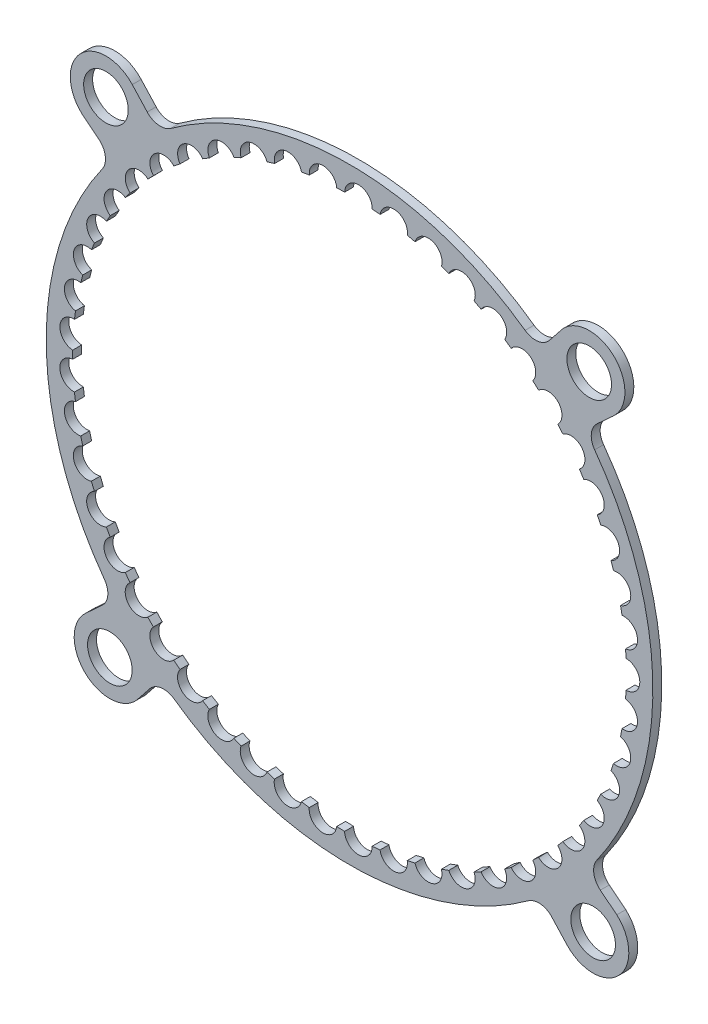
from build123d import *

# Parameters (mm, degrees)
SKETCH_1_R      = 2.5
EXTRUDE_1_DEPTH = 1


with BuildPart() as part:
    # 草图1 → 凸台-拉伸1 (new body)
    with BuildSketch(Plane.XY):
        with BuildLine():
            Line((24.353070518, -29.56688995), (22.681496979, -27.740758728))
            ThreePointArc((22.681496979, -27.740758728), (21.405560026, -27.101120587), (20.028107344, -27.474987101))
            ThreePointArc((20.028107344, -27.474987101), (0.214755371, -33.99932176), (-19.679433767, -27.725798214))
            ThreePointArc((-19.679433767, -27.725798214), (-21.116809592, -27.376390887), (-22.401146138, -28.110294408))
            Line((-22.401146138, -28.110294408), (-23.8723102, -29.956398828))
            ThreePointArc((-23.8723102, -29.956398828), (-29.671572633, -30.154780757), (-29.56688995, -24.353070518))
            Line((-29.56688995, -24.353070518), (-27.740758728, -22.681496979))
            ThreePointArc((-27.740758728, -22.681496979), (-27.101120587, -21.405560026), (-27.474987101, -20.028107344))
            ThreePointArc((-27.474987101, -20.028107344), (-33.99932176, -0.214755371), (-27.725798214, 19.679433767))
            ThreePointArc((-27.725798214, 19.679433767), (-27.376390887, 21.116809592), (-28.110294408, 22.401146138))
            Line((-28.110294408, 22.401146138), (-29.956398828, 23.8723102))
            ThreePointArc((-29.956398828, 23.8723102), (-30.154780757, 29.671572633), (-24.353070518, 29.56688995))
            Line((-24.353070518, 29.56688995), (-22.681496979, 27.740758728))
            ThreePointArc((-22.681496979, 27.740758728), (-21.405560026, 27.101120587), (-20.028107344, 27.474987101))
            ThreePointArc((-20.028107344, 27.474987101), (-0.214755371, 33.99932176), (19.679433767, 27.725798214))
            ThreePointArc((19.679433767, 27.725798214), (21.116809592, 27.376390887), (22.401146138, 28.110294408))
            Line((22.401146138, 28.110294408), (23.8723102, 29.956398828))
            ThreePointArc((23.8723102, 29.956398828), (29.671572633, 30.154780757), (29.56688995, 24.353070518))
            Line((29.56688995, 24.353070518), (27.740758728, 22.681496979))
            ThreePointArc((27.740758728, 22.681496979), (27.101120587, 21.405560026), (27.474987101, 20.028107344))
            ThreePointArc((27.474987101, 20.028107344), (33.99932176, 0.214755371), (27.725798214, -19.679433767))
            ThreePointArc((27.725798214, -19.679433767), (27.376390887, -21.116809592), (28.110294408, -22.401146138))
            Line((28.110294408, -22.401146138), (29.956398828, -23.8723102))
            ThreePointArc((29.956398828, -23.8723102), (30.154780757, -29.671572633), (24.353070518, -29.56688995))
        make_face()
        with Locations((27.303601865, -26.86608178)):
            Circle(SKETCH_1_R, mode=Mode.SUBTRACT)
        with Locations((-26.86608178, -27.303601865)):
            Circle(SKETCH_1_R, mode=Mode.SUBTRACT)
        with Locations((-27.303601865, 26.86608178)):
            Circle(SKETCH_1_R, mode=Mode.SUBTRACT)
        with Locations((26.86608178, 27.303601865)):
            Circle(SKETCH_1_R, mode=Mode.SUBTRACT)
        with BuildLine():
            Line((30.967380809, -1.988171813), (30.995571706, -1.54907584))
            ThreePointArc((30.995571706, -1.54907584), (32.086109964, -1.093363959), (32.535, 0))
            ThreePointArc((32.535, 0), (32.082923383, 1.086913605), (30.996191231, 1.539426235))
            Line((30.996191231, 1.539426235), (30.967380809, 1.988171813))
            Line((30.967380809, 1.988171813), (30.939189912, 2.427267786))
            ThreePointArc((30.939189912, 2.427267786), (31.962499724, 3.018693216), (32.2678881, 4.160483455))
            ThreePointArc((32.2678881, 4.160483455), (31.680531599, 5.18066324), (30.544855472, 5.490492524))
            Line((30.544855472, 5.490492524), (30.458897272, 5.931869712))
            Line((30.458897272, 5.931869712), (30.374787475, 6.363755741))
            ThreePointArc((30.374787475, 6.363755741), (31.314066123, 7.081183531), (31.470938369, 8.252651887))
            ThreePointArc((31.470938369, 8.252651887), (30.757946362, 9.189346528), (29.59197403, 9.351405078))
            Line((29.59197403, 9.351405078), (29.450279484, 9.778166475))
            Line((29.450279484, 9.778166475), (29.311631868, 10.195751004))
            ThreePointArc((29.311631868, 10.195751004), (30.151456422, 11.027401009), (30.1572367, 12.209312004))
            ThreePointArc((30.1572367, 12.209312004), (29.330316496, 13.047141), (28.153193193, 13.05876782))
            Line((28.153193193, 13.05876782), (27.958088921, 13.463906015))
            Line((27.958088921, 13.463906015), (27.767180076, 13.860332317))
            ThreePointArc((27.767180076, 13.860332317), (28.493760639, 14.792548867), (28.348354039, 15.965495554))
            ThreePointArc((28.348354039, 15.965495554), (27.421083643, 16.690701777), (26.252137703, 16.551705954))
            Line((26.252137703, 16.551705954), (26.006827311, 16.92856859))
            Line((26.006827311, 16.92856859), (25.766791955, 17.297327356))
            ThreePointArc((25.766791955, 17.297327356), (26.368198095, 18.314803482), (26.073992187, 19.45952611))
            ThreePointArc((26.073992187, 19.45952611), (25.061597356, 20.060201693), (23.920022836, 19.772865535))
            Line((23.920022836, 19.772865535), (23.628534316, 20.115264537))
            Line((23.628534316, 20.115264537), (23.343313822, 20.450300759))
            ThreePointArc((23.343313822, 20.450300759), (23.809670467, 21.536329529), (23.371496105, 22.634031784))
            ThreePointArc((23.371496105, 22.634031784), (22.290600333, 23.100313652), (21.195141857, 22.66935521))
            Line((21.195141857, 22.66935521), (20.86226144, 22.971668396))
            Line((20.86226144, 22.971668396), (20.536539122, 23.267480788))
            ThreePointArc((20.536539122, 23.267480788), (20.860188709, 24.404229642), (20.285240703, 25.436887282))
            ThreePointArc((20.285240703, 25.436887282), (19.153592268, 25.761119099), (18.122237234, 25.193614699))
            Line((18.122237234, 25.193614699), (17.753430809, 25.450878096))
            Line((17.753430809, 25.450878096), (17.392555017, 25.702609426))
            ThreePointArc((17.392555017, 25.702609426), (17.568183228, 26.871412978), (16.86590221, 27.822069794))
            ThreePointArc((16.86590221, 27.822069794), (15.702082748, 27.998927682), (14.751765976, 27.304195731))
            Line((14.751765976, 27.304195731), (14.353089334, 27.51218508))
            Line((14.353089334, 27.51218508), (13.962985639, 27.715701928))
            ThreePointArc((13.962985639, 27.715701928), (13.987708665, 28.897368456), (13.169626068, 29.75041469))
            ThreePointArc((13.169626068, 29.75041469), (11.992745464, 29.776994647), (11.139071129, 28.966442625))
            Line((11.139071129, 28.966442625), (10.717070529, 29.121742746))
            Line((10.717070529, 29.121742746), (10.304144423, 29.27370337))
            ThreePointArc((10.304144423, 29.27370337), (10.177556312, 30.448829943), (9.257105031, 31.190258599))
            ThreePointArc((9.257105031, 31.190258599), (8.08648763, 31.066124184), (7.343473042, 30.153061331))
            Line((7.343473042, 30.153061331), (6.905077723, 30.253122202))
            Line((6.905077723, 30.253122202), (6.476109441, 30.351031413))
            ThreePointArc((6.476109441, 30.351031413), (6.200288765, 31.500322484), (5.192582585, 32.117959323))
            ThreePointArc((5.192582585, 32.117959323), (4.047449894, 31.84514882), (3.427295331, 30.844567604))
            Line((3.427295331, 30.844567604), (2.979703731, 30.887746227))
            Line((2.979703731, 30.887746227), (2.541736921, 30.929996359))
            ThreePointArc((2.541736921, 30.929996359), (2.121212649, 32.034580601), (1.042798076, 32.518284044))
            ThreePointArc((1.042798076, 32.518284044), (-0.058046858, 32.101276993), (-0.545158475, 31.029606929))
            Line((-0.545158475, 31.029606929), (-0.994596914, 31.015194313))
            Line((-0.994596914, 31.015194313), (-1.434370849, 31.001091619))
            ThreePointArc((-1.434370849, 31.001091619), (-1.992693721, 32.04283179), (-3.124109148, 32.38465944))
            ThreePointArc((-3.124109148, 32.38465944), (-4.162590483, 31.830303085), (-4.508660794, 30.705140967))
            Line((-4.508660794, 30.705140967), (-4.952566305, 30.633373766))
            Line((-4.952566305, 30.633373766), (-5.38692629, 30.563149813))
            ThreePointArc((-5.38692629, 30.563149813), (-6.073880114, 31.524940566), (-7.239718586, 31.719279623))
            ThreePointArc((-7.239718586, 31.719279623), (-8.198784487, 31.03667648), (-8.398131027, 29.876497439))
            Line((-8.398131027, 29.876497439), (-8.829214694, 29.748554069))
            Line((-8.829214694, 29.748554069), (-9.25102855, 29.623361931))
            ThreePointArc((-9.25102855, 29.623361931), (-10.055333565, 30.489410691), (-11.236452046, 30.533070111))
            ThreePointArc((-11.236452046, 30.533070111), (-12.100354676, 29.733428506), (-12.149704181, 28.557282649))
            Line((-12.149704181, 28.557282649), (-12.560887622, 28.375263936))
            Line((-12.560887622, 28.375263936), (-12.963229176, 28.197159265))
            ThreePointArc((-12.963229176, 28.197159265), (-13.871678716, 28.953245534), (-15.048683273, 28.845508433))
            ThreePointArc((-15.048683273, 28.845508433), (-15.803237376, 27.941958458), (-15.701779528, 26.769158067))
            Line((-15.701779528, 26.769158067), (-16.086311123, 26.536052754))
            Line((-16.086311123, 26.536052754), (-16.462573939, 26.307960024))
            ThreePointArc((-16.462573939, 26.307960024), (-17.460251286, 26.941668887), (-18.613815537, 26.684304303))
            ThreePointArc((-18.613815537, 26.684304303), (-19.246631355, 25.691682224), (-18.996032089, 24.54148465))
            Line((-18.996032089, 24.54148465), (-19.347597839, 24.26112032))
            Line((-19.347597839, 24.26112032), (-19.691603692, 23.986784807))
            ThreePointArc((-19.691603692, 23.986784807), (-20.762127012, 24.487710781), (-21.873309465, 24.084944635))
            ThreePointArc((-21.873309465, 24.084944635), (-22.373996179, 23.019549278), (-21.978370329, 21.910840733))
            Line((-21.978370329, 21.910840733), (-22.291197534, 21.58782096))
            Line((-22.291197534, 21.58782096), (-22.597297857, 21.271747246))
            ThreePointArc((-22.597297857, 21.271747246), (-23.723089187, 21.631665141), (-24.773644256, 21.090110841))
            ThreePointArc((-24.773644256, 21.090110841), (-25.133980605, 19.96943597), (-24.599824335, 18.920421417))
            Line((-24.599824335, 18.920421417), (-24.868776382, 18.560050177))
            Line((-24.868776382, 18.560050177), (-25.131945015, 18.207428184))
            ThreePointArc((-25.131945015, 18.207428184), (-26.294518894, 18.420428158), (-27.267196493, 17.748978011))
            ThreePointArc((-27.267196493, 17.748978011), (-27.481265764, 16.591425075), (-26.817349906, 15.619329305))
            Line((-26.817349906, 15.619329305), (-27.038010609, 15.227523883))
            Line((-27.038010609, 15.227523883), (-27.253926332, 14.844143654))
            ThreePointArc((-27.253926332, 14.844143654), (-28.434193327, 14.906728253), (-29.313022117, 14.116407452))
            ThreePointArc((-29.313022117, 14.116407452), (-29.377309298, 12.940983439), (-28.594535333, 12.061768238))
            Line((-28.594535333, 12.061768238), (-28.763281449, 11.644962069))
            Line((-28.763281449, 11.644962069), (-28.928398932, 11.237118695))
            ThreePointArc((-28.928398932, 11.237118695), (-30.106979092, 11.148260283), (-30.877528729, 10.252045873))
            ThreePointArc((-30.877528729, 10.252045873), (-30.790978227, 9.078051213), (-29.902199281, 8.306153269))
            Line((-29.902199281, 8.306153269), (-30.016260004, 7.871190298))
            Line((-30.016260004, 7.871190298), (-30.127868021, 7.445580559))
            ThreePointArc((-30.127868021, 7.445580559), (-31.285409092, 7.206738187), (-31.935027173, 6.219345985))
            ThreePointArc((-31.935027173, 6.219345985), (-31.699060144, 5.066057637), (-30.718869943, 4.414151493))
            Line((-30.718869943, 4.414151493), (-30.776372398, 3.968173801))
            Line((-30.776372398, 3.968173801), (-30.832638349, 3.531786195))
            ThreePointArc((-30.832638349, 3.531786195), (-31.95013354, 3.146881649), (-32.468153353, 2.084524607))
            ThreePointArc((-32.468153353, 2.084524607), (-32.08664437, 0.970879535), (-31.031137609, 0.449669472))
            Line((-31.031137609, 0.449669472), (-31.031137609, 0))
            Line((-31.031137609, 0), (-31.031137609, -0.44))
            ThreePointArc((-31.031137609, -0.44), (-32.090237679, -0.964646598), (-32.468153353, -2.084524607))
            ThreePointArc((-32.468153353, -2.084524607), (-31.947366782, -3.140240383), (-30.833874854, -3.522196109))
            Line((-30.833874854, -3.522196109), (-30.776372398, -3.968173801))
            Line((-30.776372398, -3.968173801), (-30.720106447, -4.404561407))
            ThreePointArc((-30.720106447, -4.404561407), (-31.703421002, -5.060335375), (-31.935027173, -6.219345985))
            ThreePointArc((-31.935027173, -6.219345985), (-31.283514316, -7.19979764), (-30.130320726, -7.436227328))
            Line((-30.130320726, -7.436227328), (-30.016260004, -7.871190298))
            Line((-30.016260004, -7.871190298), (-29.904651987, -8.296800038))
            ThreePointArc((-29.904651987, -8.296800038), (-30.796035029, -9.072933585), (-30.877528729, -10.252045873))
            ThreePointArc((-30.877528729, -10.252045873), (-30.105987409, -11.141134419), (-28.932027565, -11.2281559))
            Line((-28.932027565, -11.2281559), (-28.763281449, -11.644962069))
            Line((-28.763281449, -11.644962069), (-28.598163967, -12.052805442))
            ThreePointArc((-28.598163967, -12.052805442), (-29.382979012, -12.936554477), (-29.313022117, -14.116407452))
            ThreePointArc((-29.313022117, -14.116407452), (-28.434121021, -14.899534079), (-27.258671312, -14.835718462))
            Line((-27.258671312, -14.835718462), (-27.038010609, -15.227523883))
            Line((-27.038010609, -15.227523883), (-26.822094886, -15.610904113))
            ThreePointArc((-26.822094886, -15.610904113), (-27.487455292, -16.587757501), (-27.267196493, -17.748978011))
            ThreePointArc((-27.267196493, -17.748978011), (-26.295367152, -18.413283801), (-25.137728429, -18.199678937))
            Line((-25.137728429, -18.199678937), (-24.868776382, -18.560050177))
            Line((-24.868776382, -18.560050177), (-24.605607749, -18.912672171))
            ThreePointArc((-24.605607749, -18.912672171), (-25.140588316, -19.966590006), (-24.773644256, -21.090110841))
            ThreePointArc((-24.773644256, -21.090110841), (-23.724844081, -21.624687913), (-22.60402474, -21.264801187))
            Line((-22.60402474, -21.264801187), (-22.291197534, -21.58782096))
            Line((-22.291197534, -21.58782096), (-21.985097212, -21.903894674))
            ThreePointArc((-21.985097212, -21.903894674), (-22.380913575, -23.017571655), (-21.873309465, -24.084944635))
            ThreePointArc((-21.873309465, -24.084944635), (-20.764759726, -24.481015246), (-19.699163589, -23.98075599))
            Line((-19.699163589, -23.98075599), (-19.347597839, -24.26112032))
            Line((-19.347597839, -24.26112032), (-19.003591987, -24.535455832))
            ThreePointArc((-19.003591987, -24.535455832), (-19.253744852, -25.690605414), (-18.613815537, -26.684304303))
            ThreePointArc((-18.613815537, -26.684304303), (-17.463718591, -26.935364987), (-16.470842718, -26.302947442))
            Line((-16.470842718, -26.302947442), (-16.086311123, -26.536052754))
            Line((-16.086311123, -26.536052754), (-15.710048307, -26.764145484))
            ThreePointArc((-15.710048307, -26.764145484), (-15.810430171, -27.941800142), (-15.048683273, -28.845508433))
            ThreePointArc((-15.048683273, -28.845508433), (-13.87592368, -28.947436778), (-12.972071064, -28.193245224))
            Line((-12.972071064, -28.193245224), (-12.560887622, -28.375263936))
            Line((-12.560887622, -28.375263936), (-12.158546068, -28.553368607))
            ThreePointArc((-12.158546068, -28.553368607), (-12.107508663, -29.734191284), (-11.236452046, -30.533070111))
            ThreePointArc((-11.236452046, -30.533070111), (-10.060286485, -30.484192458), (-9.260298362, -29.620610699))
            Line((-9.260298362, -29.620610699), (-8.829214694, -29.748554069))
            Line((-8.829214694, -29.748554069), (-8.407400839, -29.873746207))
            ThreePointArc((-8.407400839, -29.873746207), (-8.205782198, -31.038347828), (-7.239718586, -31.719279623))
            ThreePointArc((-7.239718586, -31.719279623), (-6.079459664, -31.520398541), (-5.396471817, -30.561606566))
            Line((-5.396471817, -30.561606566), (-4.952566305, -30.633373766))
            Line((-4.952566305, -30.633373766), (-4.51820632, -30.70359772))
            ThreePointArc((-4.51820632, -30.70359772), (-4.169317016, -31.832855558), (-3.124109148, -32.38465944))
            ThreePointArc((-3.124109148, -32.38465944), (-1.998808284, -32.039040551), (-1.444035353, -31.000781697))
            Line((-1.444035353, -31.000781697), (-0.994596914, -31.015194313))
            Line((-0.994596914, -31.015194313), (-0.554822979, -31.029297008))
            ThreePointArc((-0.554822979, -31.029297008), (-0.064391764, -32.10466868), (1.042798076, -32.518284044))
            ThreePointArc((1.042798076, -32.518284044), (2.114663474, -32.031602401), (2.53211213, -30.930924851))
            Line((2.53211213, -30.930924851), (2.979703731, -30.887746227))
            Line((2.979703731, -30.887746227), (3.41767054, -30.845496096))
            ThreePointArc((3.41767054, -30.845496096), (4.041590799, -31.84932403), (5.192582585, -32.117959323))
            ThreePointArc((5.192582585, -32.117959323), (6.193412515, -31.498206225), (6.466682403, -30.353183073))
            Line((6.466682403, -30.353183073), (6.905077723, -30.253122202))
            Line((6.905077723, -30.253122202), (7.334046004, -30.155212991))
            ThreePointArc((7.334046004, -30.155212991), (8.081210553, -31.07101436), (9.257105031, -31.190258599))
            ThreePointArc((9.257105031, -31.190258599), (10.170465894, -30.447610374), (10.295069929, -29.277042868))
            Line((10.295069929, -29.277042868), (10.717070529, -29.121742746))
            Line((10.717070529, -29.121742746), (11.129996635, -28.969782123))
            ThreePointArc((11.129996635, -28.969782123), (11.988137053, -29.782519493), (13.169626068, -29.75041469))
            ThreePointArc((13.169626068, -29.75041469), (13.980520504, -28.897065602), (13.954412692, -27.720174429))
            Line((13.954412692, -27.720174429), (14.353089334, -27.51218508))
            Line((14.353089334, -27.51218508), (14.743193029, -27.308668233))
            ThreePointArc((14.743193029, -27.308668233), (15.698218674, -28.004996479), (16.86590221, -27.822069794))
            ThreePointArc((16.86590221, -27.822069794), (17.561015355, -26.872031812), (17.384624384, -25.708141492))
            Line((17.384624384, -25.708141492), (17.753430809, -25.450878096))
            Line((17.753430809, -25.450878096), (18.114306601, -25.199146765))
            ThreePointArc((18.114306601, -25.199146765), (19.150535979, -25.767632198), (20.285240703, -25.436887282))
            ThreePointArc((20.285240703, -25.436887282), (20.853158818, -24.405760003), (20.529381024, -23.273981583))
            Line((20.529381024, -23.273981583), (20.86226144, -22.971668396))
            Line((20.86226144, -22.971668396), (21.187983759, -22.675856005))
            ThreePointArc((21.187983759, -22.675856005), (22.288402012, -23.107164108), (23.371496105, -22.634031784))
            ThreePointArc((23.371496105, -22.634031784), (23.80289399, -21.538746289), (23.337045796, -20.457663539))
            Line((23.337045796, -20.457663539), (23.628534316, -20.115264537))
            Line((23.628534316, -20.115264537), (23.91375481, -19.780228315))
            ThreePointArc((23.91375481, -19.780228315), (25.0602931, -20.067277022), (26.073992187, -19.45952611))
            ThreePointArc((26.073992187, -19.45952611), (26.361786301, -18.318066956), (25.76151692, -17.305431226))
            Line((25.76151692, -17.305431226), (26.006827311, -16.92856859))
            Line((26.006827311, -16.92856859), (26.246862668, -16.559809824))
            ThreePointArc((26.246862668, -16.559809824), (27.420694869, -16.697885803), (28.348354039, -15.965495554))
            ThreePointArc((28.348354039, -15.965495554), (28.48781881, -14.79660547), (27.762984649, -13.86904421))
            Line((27.762984649, -13.86904421), (27.958088921, -13.463906015))
            Line((27.958088921, -13.463906015), (28.148997767, -13.067479713))
            ThreePointArc((28.148997767, -13.067479713), (29.330849585, -13.05431576), (30.1572367, -12.209312004))
            ThreePointArc((30.1572367, -12.209312004), (30.146082121, -11.032184132), (29.308584938, -10.204927872))
            Line((29.308584938, -10.204927872), (29.450279484, -9.778166475))
            Line((29.450279484, -9.778166475), (29.5889271, -9.360581947))
            ThreePointArc((29.5889271, -9.360581947), (30.759392563, -9.196394213), (31.470938369, -8.252651887))
            ThreePointArc((31.470938369, -8.252651887), (31.309347598, -7.086614635), (30.372939072, -6.3732469))
            Line((30.372939072, -6.3732469), (30.458897272, -5.931869712))
            Line((30.458897272, -5.931869712), (30.543007069, -5.499983683))
            ThreePointArc((30.543007069, -5.499983683), (31.682867165, -5.187468128), (32.2678881, -4.160483455))
            ThreePointArc((32.2678881, -4.160483455), (31.958514452, -3.024683122), (30.938570387, -2.436917391))
            Line((30.938570387, -2.436917391), (30.967380809, -1.988171813))
        make_face(mode=Mode.SUBTRACT)
    extrude(amount=EXTRUDE_1_DEPTH)


solid = part.part
